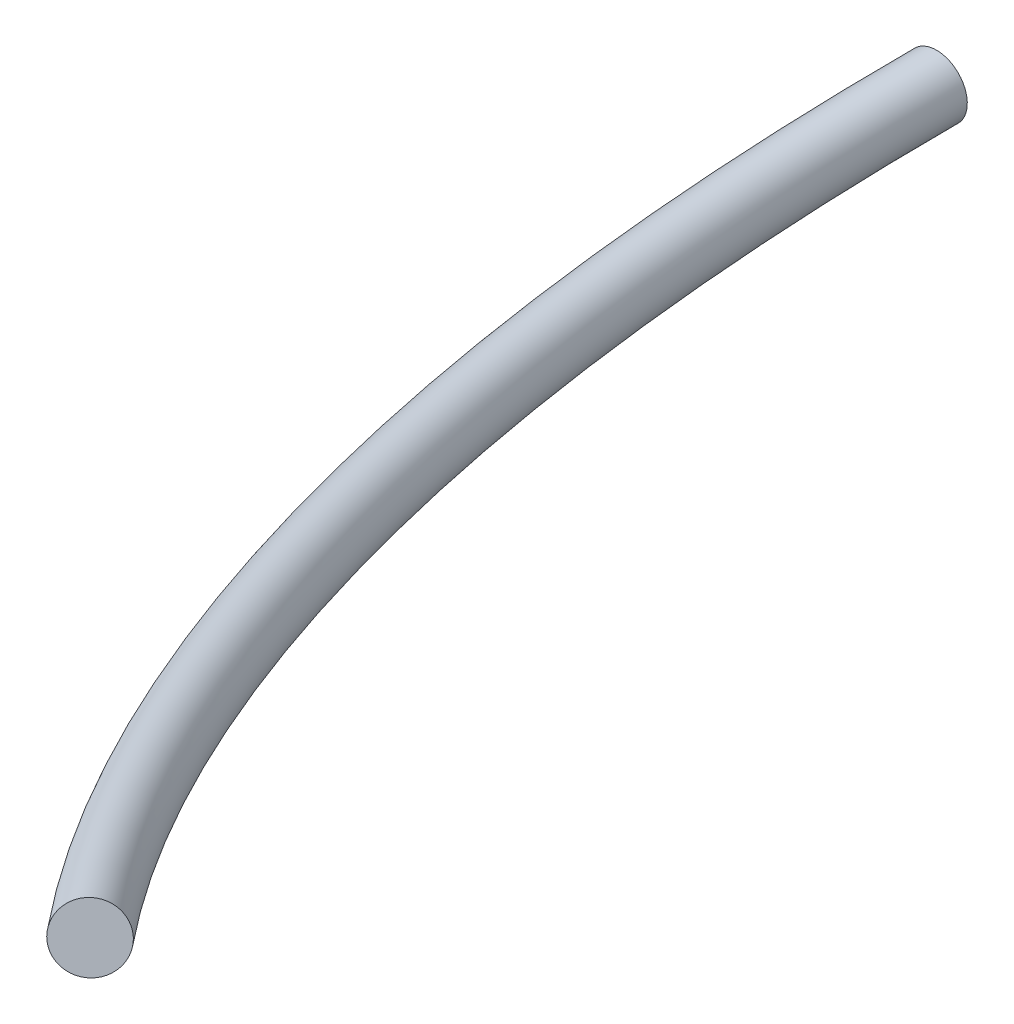
from build123d import *

# Parameters (mm, degrees)
SKETCH1_R = 50.8


with BuildPart() as part:
    # Sweep1: sweep along a path in Sketch2
    with BuildLine(Plane(origin=(3544.955422996, -9782.735764226, 0), x_dir=(0.7860235223987314, 0.2848301758818029, 0.5486700220925436), z_dir=(-0.3406900592252327, 0.9401756663225802, -3.58046925441613e-15))) as sweep1_path:
        ThreePointArc((-9800.692564255, -6431.932261533), (-8959.124515346, -7304.302001577), (-7857.365242884, -7809.665484465))
    # Sketch1 → Sweep1 (sweep)
    with BuildSketch(Plane.XY):
        with Locations((-7476.507307309, -13776.566837331)):
            Circle(SKETCH1_R)
    sweep(path=sweep1_path.line)


solid = part.part
